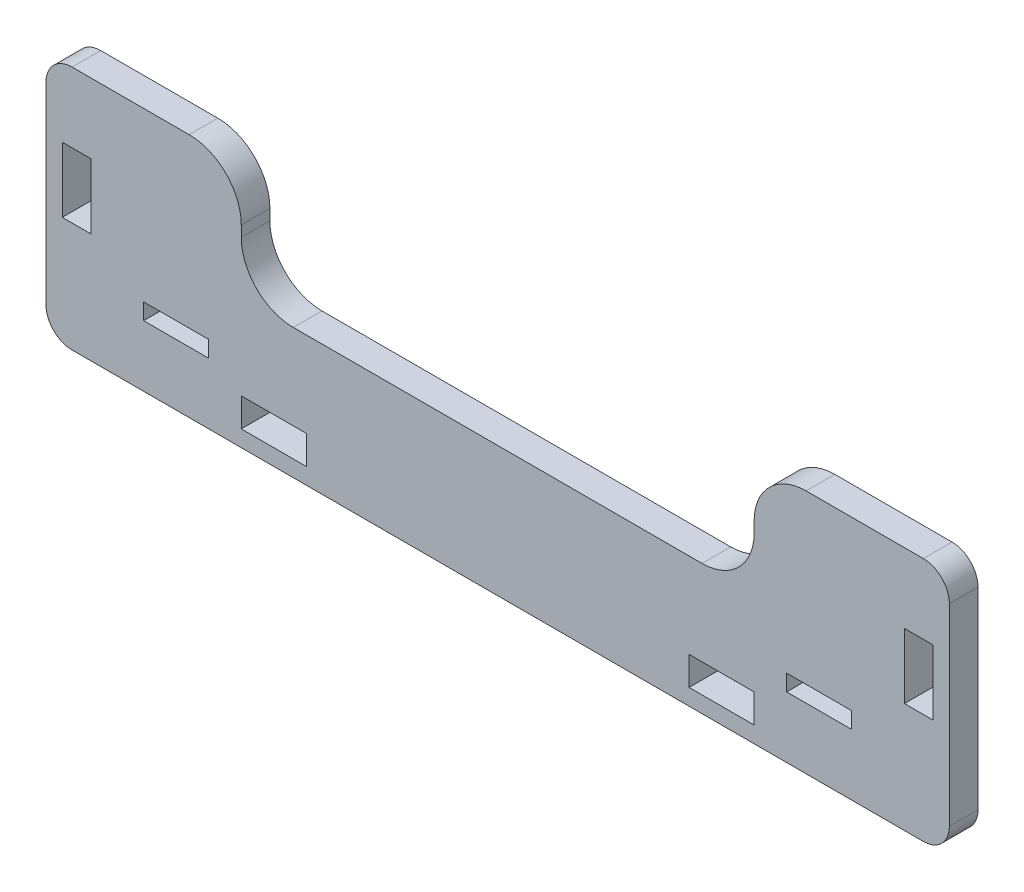
from build123d import *

# Parameters (mm, degrees)
BOSS_EXTRUDE1_DEPTH = 2.794
FILLET1_R           = 2.54
FILLET2_R           = 5.08
SKETCH2_W           = 6.35
SKETCH2_H           = 2.794
SKETCH2_W_2         = 2.794
SKETCH2_H_2         = 6.35
SKETCH2_H_3         = 1.5875
CUT_EXTRUDE1_DEPTH  = 73.220895192


with BuildPart() as part:
    # Sketch1 → Boss-Extrude1 (new body)
    with BuildSketch(Plane.XY):
        Polygon((-69.475359958, -4.3815), (18.662640042, -4.3815), (18.662640042, 19.525), (-0.387359958, 19.525), (-0.387359958, 8.3185), (-50.425359958, 8.3185), (-50.425359958, 19.525), (-69.475359958, 19.525), align=None)
    extrude(amount=BOSS_EXTRUDE1_DEPTH)

    # Fillet1
    fillet1_edges = [part.edges().sort_by_distance(p)[0] for p in [
        (-69.475359958, 19.525, 1.397),
        (18.662640042, 19.525, 1.397),
        (18.662640042, -4.3815, 1.397),
        (-69.475359958, -4.3815, 1.397),
    ]]
    fillet(fillet1_edges, radius=FILLET1_R)

    # Fillet2
    fillet2_edges = [part.edges().sort_by_distance(p)[0] for p in [
        (-0.387359958, 19.525, 1.397),
        (-0.387359958, 8.3185, 1.397),
        (-50.425359958, 8.3185, 1.397),
        (-50.425359958, 19.525, 1.397),
    ]]
    fillet(fillet2_edges, radius=FILLET2_R)

    # Sketch2 → Cut-Extrude1 (cut, through all)
    with BuildSketch(Plane.XY.offset(2.794)):
        with Locations((-47.250359958, -1.397)):
            Rectangle(SKETCH2_W, SKETCH2_H)
        with Locations((-3.562359958, -1.397)):
            Rectangle(SKETCH2_W, SKETCH2_H)
        with Locations((15.678140042, 9.525)):
            Rectangle(SKETCH2_W_2, SKETCH2_H_2)
        with Locations((-66.490859958, 9.525)):
            Rectangle(SKETCH2_W_2, SKETCH2_H_2)
        with Locations((5.962640042, 2.38125)):
            Rectangle(SKETCH2_W, SKETCH2_H_3)
        with Locations((-56.775359958, 2.38125)):
            Rectangle(SKETCH2_W, SKETCH2_H_3)
    extrude(amount=-CUT_EXTRUDE1_DEPTH, mode=Mode.SUBTRACT)


solid = part.part
